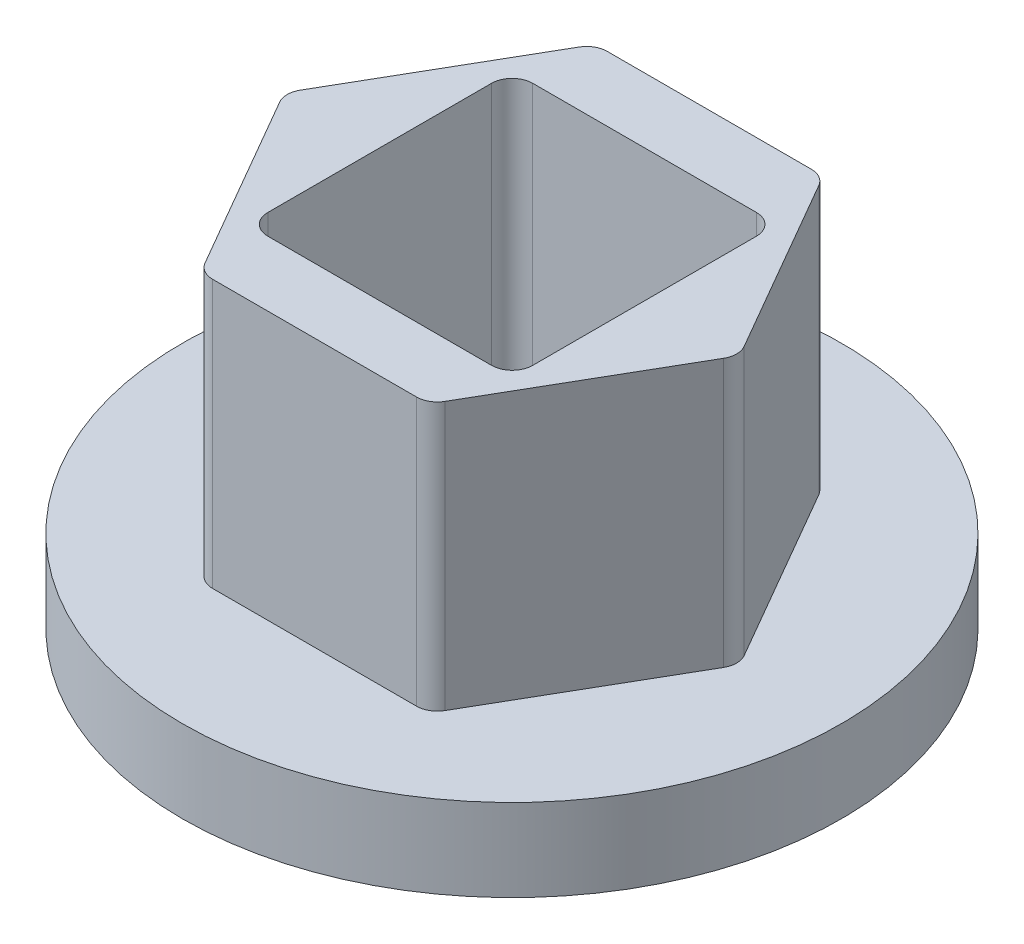
from build123d import *

# Parameters (mm, degrees)
BOSS_EXTRUDE2_DEPTH     = 6.5
SKETCH4_R               = 8
BOSS_EXTRUDE3_DEPTH     = 2
CUT_EXTRUDE1_DEPTH      = 7.37
CUT_EXTRUDE1_DEPTH_BACK = 2.37
SKETCH1_W               = 6.43
SKETCH1_H               = 6.43
FILLET1_R               = 0.5
FILLET2_R               = 0.5


with BuildPart() as part:
    # Sketch3 → Boss-Extrude2 (new body)
    with BuildSketch(Plane(origin=(0, 0, 0), x_dir=(1, 0, 0), z_dir=(0, 1, 0))):
        Polygon((2.765507789, -0.261150073), (5.531015579, 4.528849927), (2.765507789, 9.318849927), (-2.765507789, 9.318849927), (-5.531015579, 4.528849927), (-2.765507789, -0.261150073), align=None)
    extrude(amount=BOSS_EXTRUDE2_DEPTH)

    # Sketch4 → Boss-Extrude3 (add)
    with BuildSketch(Plane(origin=(0, 0, 0), x_dir=(1, 0, 0), z_dir=(0, 1, 0))):
        with Locations(Location((0, 4.528849927, 0), (0, 0, 270))):
            Circle(SKETCH4_R)
    extrude(amount=-BOSS_EXTRUDE3_DEPTH)

    # Sketch1 → Cut-Extrude1 (cut, two sides: drawn at the far end of the back side and taken through both)
    with BuildSketch(Plane(origin=(0, 0, 0), x_dir=(1, 0, 0), z_dir=(0, 1, 0)).offset(-CUT_EXTRUDE1_DEPTH_BACK)):
        with Locations((0.005, 4.528849927)):
            Rectangle(SKETCH1_W, SKETCH1_H)
    extrude(amount=CUT_EXTRUDE1_DEPTH + CUT_EXTRUDE1_DEPTH_BACK, mode=Mode.SUBTRACT)

    # Fillet1
    fillet1_edges = [part.edges().sort_by_distance(p)[0] for p in [
        (3.22, 2.25, -7.743849927),
        (-3.21, 2.25, -7.743849927),
        (-3.21, 2.25, -1.313849927),
        (3.22, 2.25, -1.313849927),
    ]]
    fillet(fillet1_edges, radius=FILLET1_R)

    # Fillet2
    fillet2_edges = [part.edges().sort_by_distance(p)[0] for p in [
        (-2.765507789, 3.25, 0.261150073),
        (-5.531015579, 3.25, -4.528849927),
        (-2.765507789, 3.25, -9.318849927),
        (2.765507789, 3.25, -9.318849927),
        (5.531015579, 3.25, -4.528849927),
        (2.765507789, 3.25, 0.261150073),
    ]]
    fillet(fillet2_edges, radius=FILLET2_R)


solid = part.part
